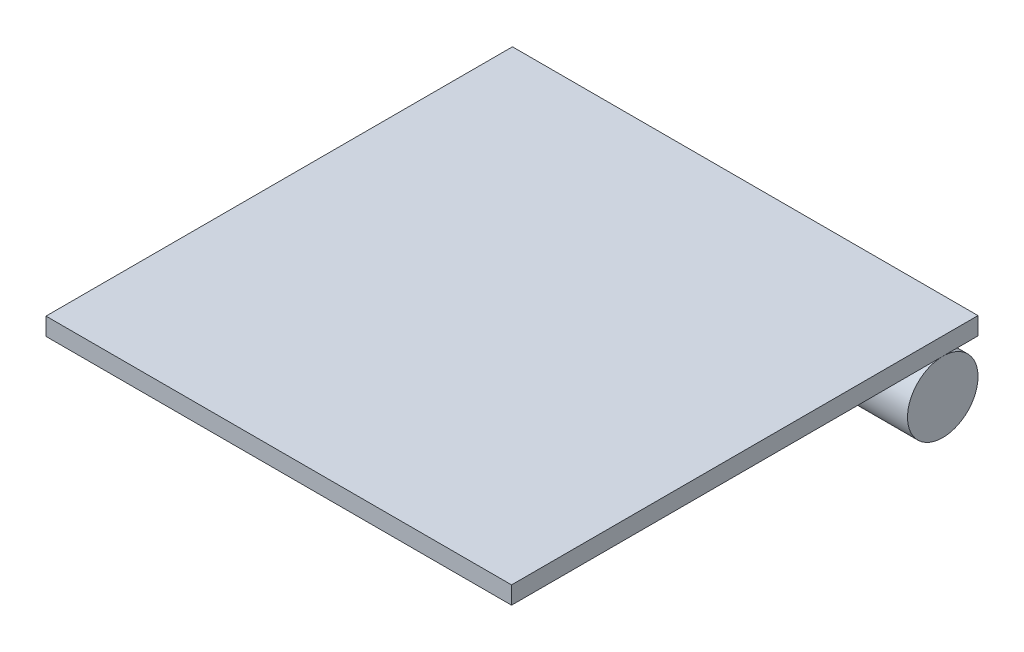
from build123d import *

# Parameters (mm, degrees)
SKIZZE1_R                         = 10
AUFSATZ_LINEAR_AUSTRAGEN1_DEPTH   = 132.08
SKIZZE1_W                         = 132.334
SKIZZE1_H                         = 5
AUFSATZ_LINEAR_AUSTRAGEN1_2_DEPTH = 132.08


with BuildPart() as part:
    # Skizze1 → Aufsatz-Linear austragen1 (new body)
    with BuildSketch(Plane(origin=(0, 0, 0), x_dir=(0, 0, -1), z_dir=(1, 0, 0))):
        with Locations((122.334, -10)):
            Circle(SKIZZE1_R)
    extrude(amount=AUFSATZ_LINEAR_AUSTRAGEN1_DEPTH)


with BuildPart() as body_2:
    # Skizze1 → Aufsatz-Linear austragen1 2 (new body)
    with BuildSketch(Plane(origin=(0, 0, 0), x_dir=(0, 0, -1), z_dir=(1, 0, 0))):
        with Locations((66.167, 2.5)):
            Rectangle(SKIZZE1_W, SKIZZE1_H)
    extrude(amount=AUFSATZ_LINEAR_AUSTRAGEN1_2_DEPTH)


solid = Compound([part.part, body_2.part])
